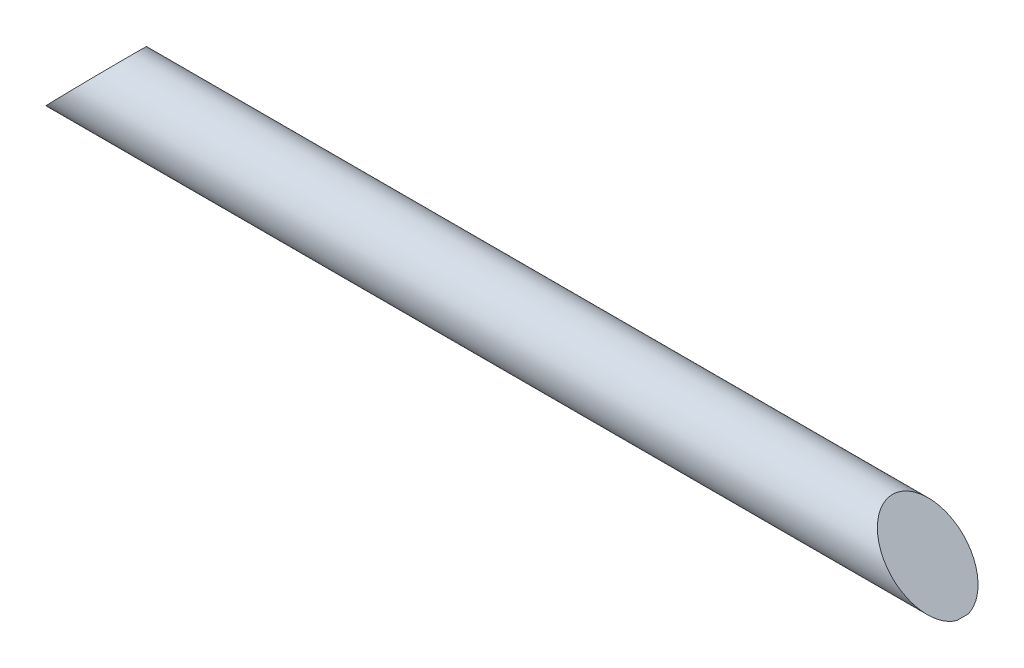
from build123d import *

# Parameters (mm, degrees)
SKETCH2_W               = 1600
SKETCH2_H               = 63.75
CUT_EXTRUDE2_DEPTH      = 1607.337546252
CUT_EXTRUDE2_DEPTH_BACK = 1607.337546252
CUT_EXTRUDE3_DEPTH      = 1607.337546252


with BuildPart() as part:
    # Sketch2 → Revolve1 (revolve)
    with BuildSketch(Plane(origin=(0, 0, 0), x_dir=(1, 0, 0), z_dir=(0, 1, 0))):
        with Locations((800, 31.875)):
            Rectangle(SKETCH2_W, SKETCH2_H)
    revolve(axis=Axis((1600, 0, -63.75), (-1, 0, 0)))

    # Sketch3 → Cut-Extrude2 (cut, two sides: drawn at the far end of the back side and taken through both)
    with BuildSketch(Plane.XY.offset(-CUT_EXTRUDE2_DEPTH_BACK)):
        Polygon((0, 63.75), (125, 63.75), (0, -63.75), align=None)
        Polygon((1600, 63.75), (1600, -63.75), (1475, 63.75), align=None)
    extrude(amount=CUT_EXTRUDE2_DEPTH + CUT_EXTRUDE2_DEPTH_BACK, mode=Mode.SUBTRACT)

    # Sketch5 → Cut-Extrude3 (cut, through all)
    with BuildSketch(Plane(origin=(0, 0, 0), x_dir=(0, 0, -1), z_dir=(1, 0, 0))):
        Polygon((63.75, -63.75), (0, -63.75), (0, -62.96232629), (127.5, -62.96232629), (127.5, -63.75), align=None)
    extrude(amount=CUT_EXTRUDE3_DEPTH, mode=Mode.SUBTRACT)


solid = part.part
